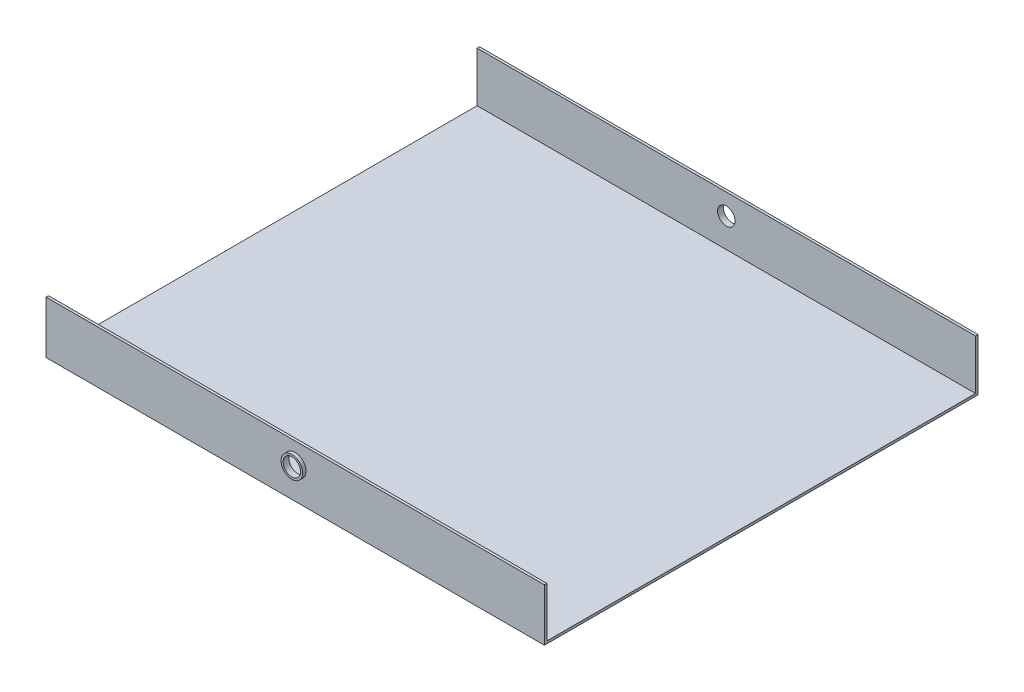
from build123d import *
from build123d.topology import SkipClean

# Parameters (mm, degrees)
VYSUNOUT_TENKOST_NN_1_DEPTH = 150
SKICA9_R                    = 5.25
ODEBRAT_VYSUNUT_M4_DEPTH    = 307.569731056
SKETCH1_R                   = 6.5
SKETCH1_R_2                 = 5.25
BOSS_EXTRUDE2_DEPTH         = 2
BOSS_EXTRUDE3_START         = 2
SKETCH2_R                   = 6.5
SKETCH2_R_2                 = 5.25
BOSS_EXTRUDE3_DEPTH         = 2
SCALE1_SCALE                = 8


with BuildPart() as part:
    # Skica4 → Vysunout tenkostěnný1 (new, symmetric)
    with BuildSketch(Plane(origin=(0, 0, 0), x_dir=(0, 0, -1), z_dir=(1, 0, 0))):
        Polygon((0, 28), (100, 28), (129, 28), (129, 58), (130.5, 58), (130.5, 26.5), (100, 26.5), (0, 26.5), align=None)
    vysunout_tenkost_nn_1 = extrude(amount=VYSUNOUT_TENKOST_NN_1_DEPTH, both=True)

    # Zrcadlit1: Vysunout tenkostěnný1 across plane
    add(vysunout_tenkost_nn_1.mirror(Plane(origin=(150, 26.5, 0), x_dir=(1, 0, 0), z_dir=(0, 0, 1))))

    # Skica9 → Odebrat vysunutím4 (cut, through all)
    with BuildSketch(Plane(origin=(0, 0, -130.5), x_dir=(-1, 0, 0), z_dir=(0, 0, -1))):
        with Locations((0, 45.5)):
            Circle(SKICA9_R)
    extrude(amount=-ODEBRAT_VYSUNUT_M4_DEPTH, mode=Mode.SUBTRACT)

    # Sketch1 → Boss-Extrude2 (add)
    with SkipClean():  # the faces are left unmerged after this step: merging them gives an invalid solid
        with BuildSketch(Plane.XY.offset(130.5)):
            with Locations((0, 45.5)):
                Circle(SKETCH1_R)
            with Locations((0, 45.5)):
                Circle(SKETCH1_R_2, mode=Mode.SUBTRACT)
        extrude(amount=BOSS_EXTRUDE2_DEPTH)

    # Sketch2 → Boss-Extrude3 (add)
    with BuildSketch(Plane(origin=(0, 0, -130.5), x_dir=(-1, 0, 0), z_dir=(0, 0, -1)).offset(BOSS_EXTRUDE3_START)):
        with Locations(Location((0, 45.5, 0), (0, 0, 180))):
            Circle(SKETCH2_R)
        with Locations(Location((0, 45.5, 0), (0, 0, 180))):
            Circle(SKETCH2_R_2, mode=Mode.SUBTRACT)
    extrude(amount=-BOSS_EXTRUDE3_DEPTH)


with BuildPart() as part_1:
    # Scale1: scaled about (0, 30.185952613, 0)
    add(part.part.scale(SCALE1_SCALE).moved(Location((0, -211.301668291, 0))))


solid = part_1.part
